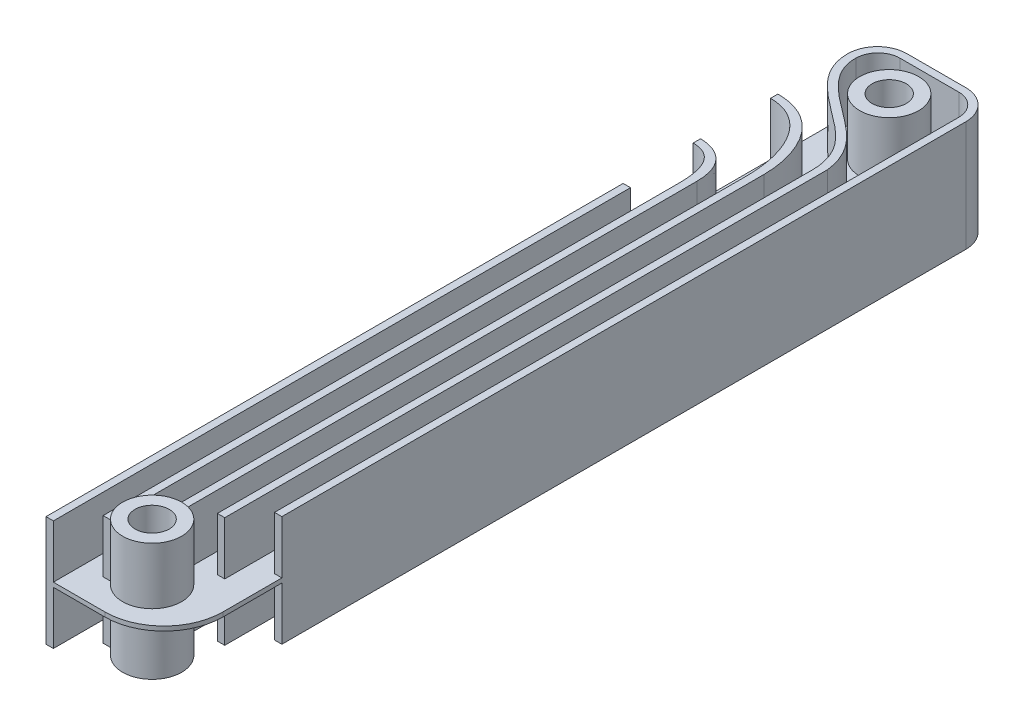
from build123d import *

# Parameters (mm, degrees)
EXTRUDE_1_DEPTH          = 1.5
SKETCH_4_R               = 20
EXTRUDE_3_DEPTH          = 40
SKETCH_3_W               = 5
SKETCH_3_H               = 391.512844762
EXTRUDE_2_DEPTH          = 37.5
CUT_EXTRUDE_1_DEPTH      = 572.048159203
CUT_EXTRUDE_1_DEPTH_BACK = 572.048159203
SKETCH_5_R               = 11.608553415


with BuildPart() as part:
    # Эскиз1 → Бобышка-Вытянуть1 (new, symmetric)
    with BuildSketch(Plane(origin=(0, 0, 0), x_dir=(1, 0, 0), z_dir=(0, 1, 0))):
        with BuildLine():
            Line((0, 0), (40, 0))
            ThreePointArc((40, 0), (68.284271247, 11.715728753), (80, 40))
            Line((80, 40), (80, 544))
            ThreePointArc((80, 544), (74.142135624, 558.142135624), (60, 564))
            Line((60, 564), (20, 564))
            ThreePointArc((20, 564), (5.857864376, 558.142135624), (0, 544))
            Line((0, 544), (0, 0))
        make_face()
    extrude(amount=EXTRUDE_1_DEPTH, both=True)

    # Эскиз4 → Бобышка-Вытянуть3 (add, symmetric)
    with BuildSketch(Plane(origin=(0, 0, 0), x_dir=(1, 0, 0), z_dir=(0, 1, 0))):
        with Locations(Location((40, 532, 0), (0, 0, 90))):
            Circle(SKETCH_4_R)
        with Locations(Location((40, 32, 0), (0, 0, 90))):
            Circle(SKETCH_4_R)
    extrude(amount=EXTRUDE_3_DEPTH, both=True)

    # Эскиз3 → Бобышка-Вытянуть2 (add, symmetric)
    with BuildSketch(Plane(origin=(0, 0, 0), x_dir=(1, 0, 0), z_dir=(0, 1, 0))):
        with Locations((2.5, 195.756422381)):
            Rectangle(SKETCH_3_W, SKETCH_3_H)
        with BuildLine():
            Line((18.75, 20), (18.75, 410.960618119))
            add(Edge.make_bspline(
                [(18.75, 410.960618119), (18.619343314, 432.823453962), (10.714456062, 438.750588709), (0, 439.008563175)],
                knots=[0, 0, 0, 0, 0.383310018, 0.383310018, 0.383310018, 0.383310018], degree=3))
            Line((0, 439.008563175), (0, 444.008563175))
            add(Edge.make_bspline(
                [(23.75, 418.032535703), (23.651084824, 434.584052037), (14.702133723, 443.654576461), (0, 444.008563175)],
                knots=[0, 0, 0, 0, 0.45109493, 0.45109493, 0.45109493, 0.45109493], degree=3))
            Line((23.75, 418.032535703), (23.75, 20))
            Line((23.75, 20), (18.75, 20))
        make_face()
        with BuildLine():
            Line((37.5, 437.480309059), (37.5, 40))
            Line((37.5, 40), (42.5, 40))
            Line((42.5, 40), (42.5, 444.552226644))
            add(Edge.make_bspline(
                [(42.5, 444.552226644), (42.5, 468.504808265), (29.924280178, 496.504281587), (0, 496.504281587)],
                knots=[0, 0, 0, 0, 0.660697169, 0.660697169, 0.660697169, 0.660697169], degree=3))
            Line((0, 496.504281587), (0, 491.504281587))
            add(Edge.make_bspline(
                [(37.5, 437.480309059), (37.5, 467.72802132), (23.566080147, 491.504281587), (0, 491.504281587)],
                knots=[0, 0, 0, 0, 0.558746878, 0.558746878, 0.558746878, 0.558746878], degree=3))
        make_face()
        with BuildLine():
            Line((75, 544), (75, 80))
            Line((75, 80), (80, 80))
            Line((80, 80), (80, 544))
            ThreePointArc((80, 544), (74.142135624, 558.142135624), (60, 564))
            Line((60, 564), (20, 564))
            ThreePointArc((20, 564), (5.857864376, 558.142135624), (0, 544))
            add(Edge.make_bspline(
                [(56.25, 464), (55.888176691, 484.43055731), (40.32858557, 495.337691462), (11.678032306, 517.066181425), (-0.142768965, 529.416172676), (0, 544)],
                knots=[0, 0, 0, 0, 0.386950656, 0.462925012, 0.759743566, 0.759743566, 0.759743566, 0.759743566], degree=3))
            Line((56.25, 464), (56.25, 60))
            Line((56.25, 60), (61.25, 60))
            Line((61.25, 60), (61.25, 469.03345623))
            add(Edge.make_bspline(
                [(5.328702081, 543.977283801), (5.324088382, 543.505995122), (5.337414741, 542.551634788), (5.457740146, 540.737815826), (5.772419448, 538.55746105), (6.395027872, 536.076029187), (7.534183828, 532.902492904), (9.515295819, 529.134829312), (12.715026204, 524.825440435), (16.628138615, 520.684283169), (22.599713472, 515.344917421), (31.035748827, 508.872702375), (39.456076798, 502.686353436), (45.806061521, 497.335661085), (50.244953026, 492.962312957), (54.215388171, 488.068335907), (56.98010164, 483.441091139), (58.765640068, 479.369374929), (59.869087857, 476.127978893), (60.576641573, 473.264417399), (61.007042583, 470.883203426), (61.177720375, 469.647902202), (61.25, 469.03345623)],
                knots=[0.029281292, 0.029281292, 0.029281292, 0.029281292, 0.040697546, 0.052113799, 0.074946306, 0.097778813, 0.120611319, 0.166276333, 0.211941347, 0.25760636, 0.303271374, 0.394601401, 0.485931428, 0.531596442, 0.577261455, 0.622926469, 0.668591483, 0.691423989, 0.714256496, 0.737089003, 0.748505256, 0.75992151, 0.75992151, 0.75992151, 0.75992151], degree=3))
            ThreePointArc((5.328702081, 543.977283801), (9.714054812, 554.598567286), (20.32868488, 559))
            Line((20.32868488, 559), (60.32868488, 559))
            ThreePointArc((60.32868488, 559), (70.772037183, 554.539597924), (75, 544))
        make_face()
    extrude(amount=EXTRUDE_2_DEPTH, both=True)

    # Эскиз5 → Вырез-Вытянуть1 (cut, two sides: drawn at the far end of the back side and taken through both)
    with BuildSketch(Plane(origin=(0, 0, 0), x_dir=(1, 0, 0), z_dir=(0, 1, 0)).offset(-CUT_EXTRUDE_1_DEPTH_BACK)):
        with Locations(Location((40, 532, 0), (0, 0, 270))):
            Circle(SKETCH_5_R)
        with Locations(Location((40, 32, 0), (0, 0, 270))):
            Circle(SKETCH_5_R)
    extrude(amount=CUT_EXTRUDE_1_DEPTH + CUT_EXTRUDE_1_DEPTH_BACK, mode=Mode.SUBTRACT)


solid = part.part
